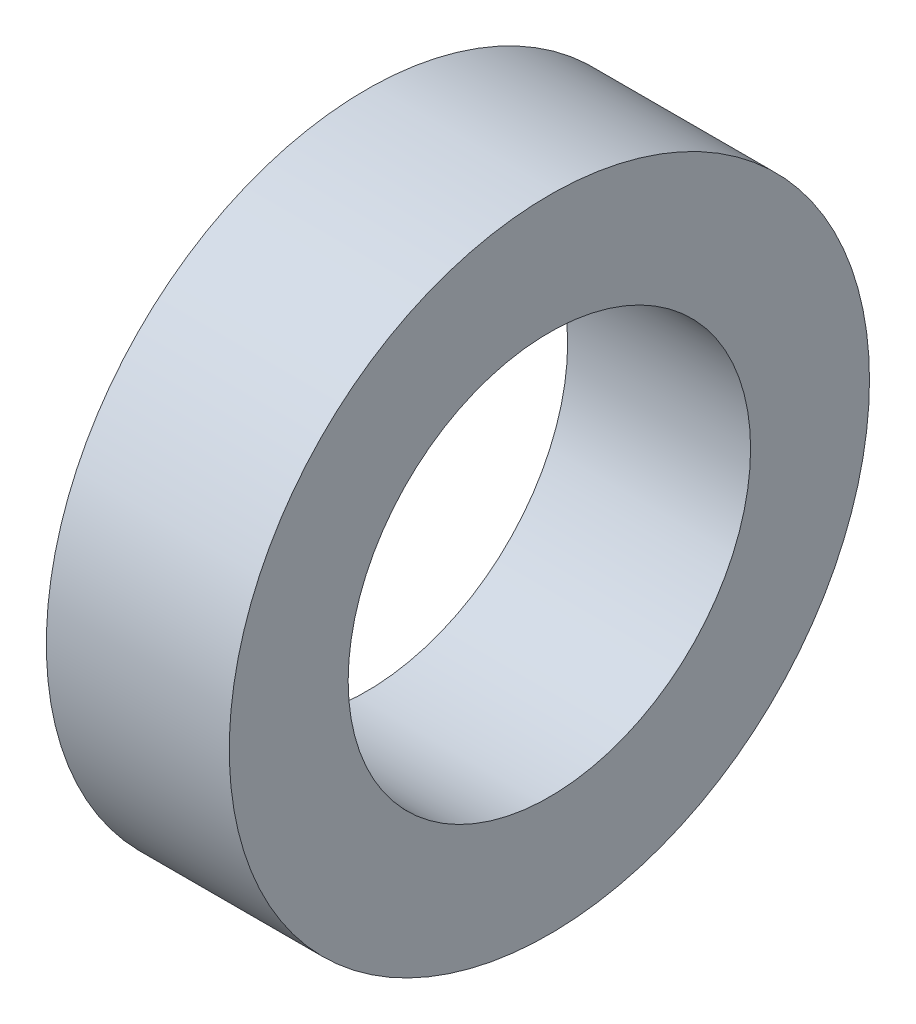
from build123d import *

# Parameters (mm, degrees)
SKETCH1_R           = 4.445
SKETCH1_R_2         = 2.794
BOSS_EXTRUDE1_DEPTH = 2.54


with BuildPart() as part:
    # Sketch1 → Boss-Extrude1 (new body)
    with BuildSketch(Plane(origin=(0, 0, 0), x_dir=(0, 0, -1), z_dir=(1, 0, 0))):
        Circle(SKETCH1_R)
        Circle(SKETCH1_R_2, mode=Mode.SUBTRACT)
    extrude(amount=BOSS_EXTRUDE1_DEPTH)


solid = part.part
